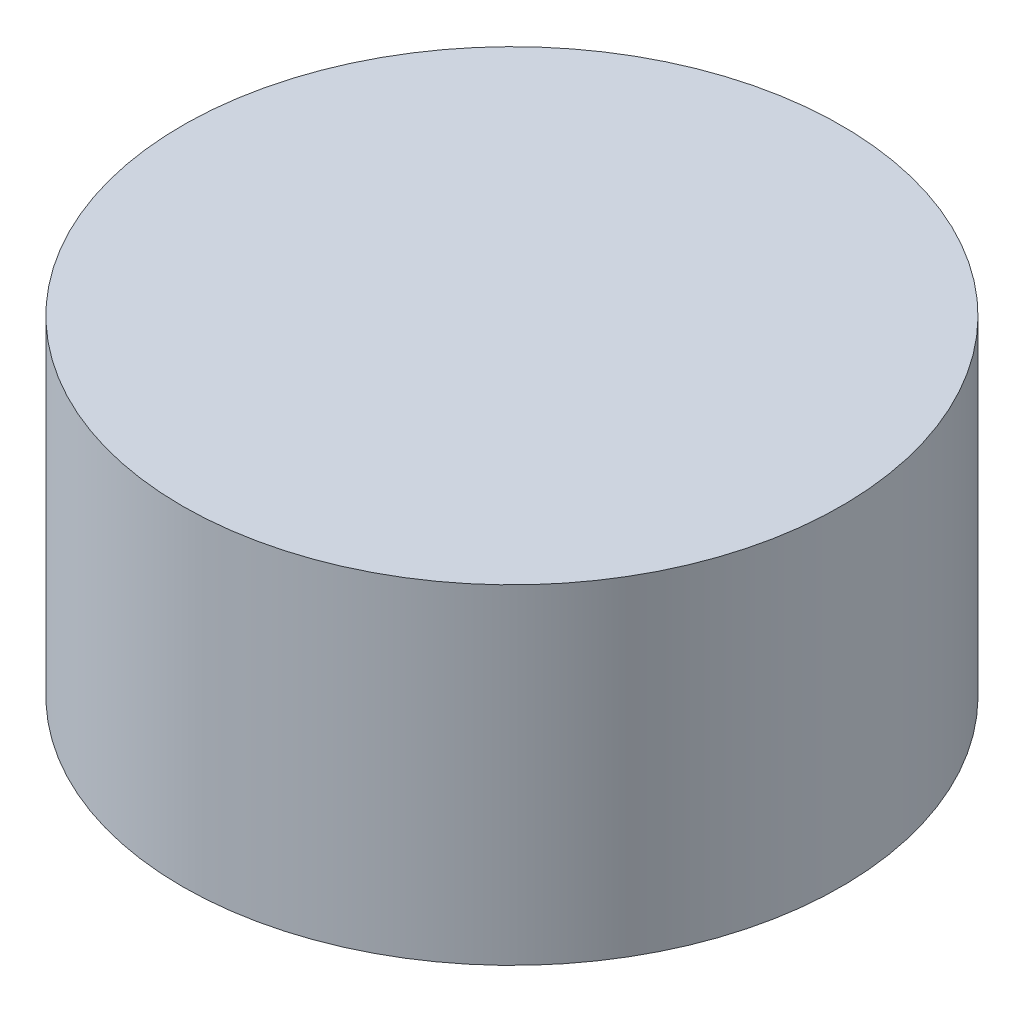
from build123d import *

# Parameters (mm, degrees)
SKETCH1_R           = 9
BOSS_EXTRUDE1_DEPTH = 9


with BuildPart() as part:
    # Sketch1 → Boss-Extrude1 (new body)
    with BuildSketch(Plane(origin=(0, 0, 0), x_dir=(1, 0, 0), z_dir=(0, 1, 0))):
        with Locations(Location((0, 0, 0), (0, 0, 270))):
            Circle(SKETCH1_R)
    extrude(amount=BOSS_EXTRUDE1_DEPTH)


solid = part.part
